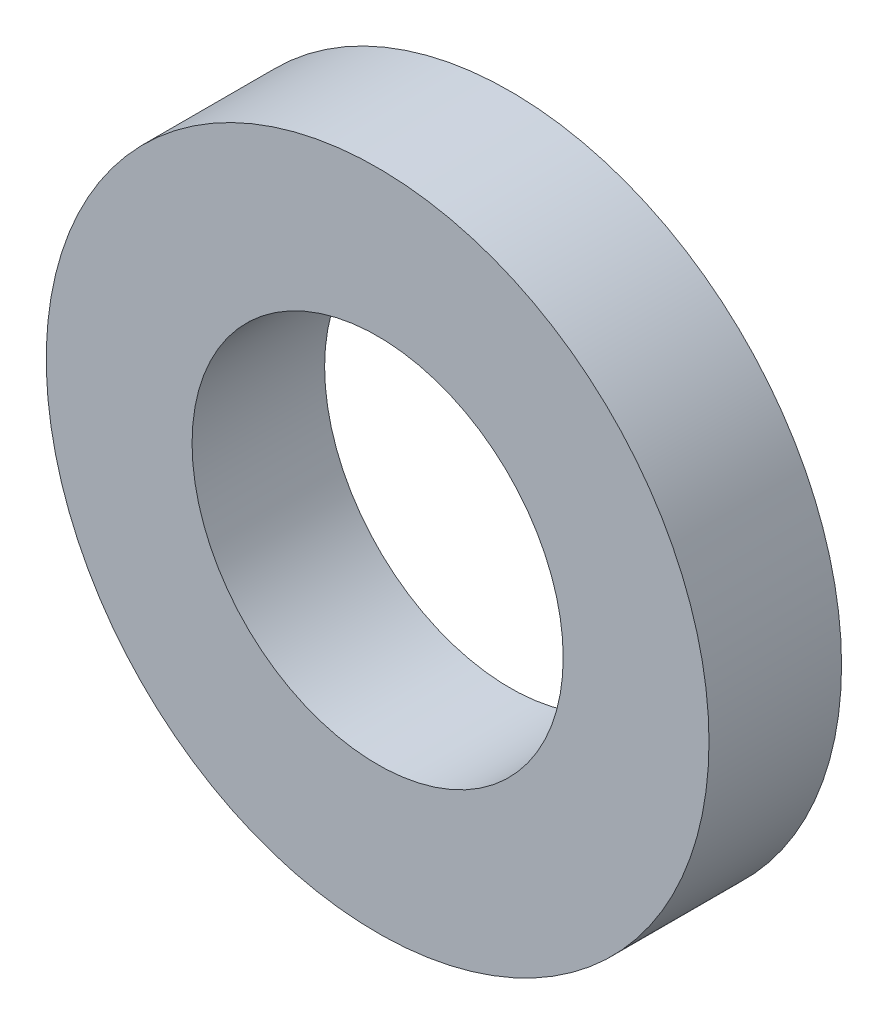
from build123d import *

# Parameters (mm, degrees)
ONE_MM_ALIGNMENT_SHIM_START = 9
SKETCH_1_R                  = 2.5
SKETCH_1_R_2                = 1.4
ONE_MM_ALIGNMENT_SHIM_DEPTH = 1


with BuildPart() as part:
    # 草图1 → One_mm_alignment_shim (new body)
    with BuildSketch(Plane.XY.offset(ONE_MM_ALIGNMENT_SHIM_START)):
        Circle(SKETCH_1_R)
        Circle(SKETCH_1_R_2, mode=Mode.SUBTRACT)
    extrude(amount=ONE_MM_ALIGNMENT_SHIM_DEPTH)


solid = part.part
